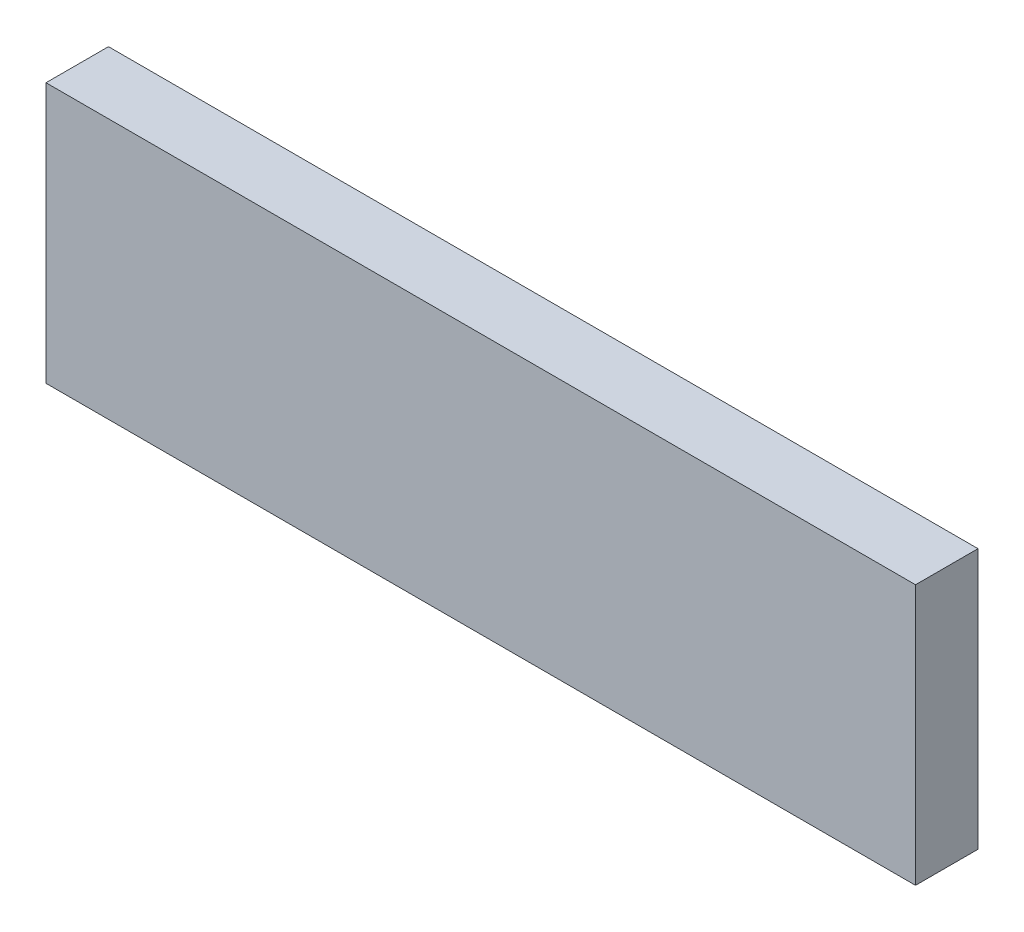
from build123d import *

# Parameters (mm, degrees)
ESBO_O1_W                = 167
ESBO_O1_H                = 50
RESSALTO_EXTRUS_O1_DEPTH = 6
ESBO_O3_R                = 1.5
CORTE_EXTRUS_O1_DEPTH    = 15


with BuildPart() as part:
    # Esboço1 → Ressalto-extrusão1 (new, symmetric)
    with BuildSketch(Plane.XY):
        Rectangle(ESBO_O1_W, ESBO_O1_H)
    extrude(amount=RESSALTO_EXTRUS_O1_DEPTH, both=True)

    # Esboço3 → Corte-extrusão1 (cut, symmetric)
    with BuildSketch(Plane(origin=(0, -25, 0), x_dir=(-1, 0, 0), z_dir=(0, -1, 0))):
        with Locations(Location((77.5, 0, 0), (0, 0, 90))):
            Circle(ESBO_O3_R)
        with Locations(Location((-77.5, 0, 0), (0, 0, 90))):
            Circle(ESBO_O3_R)
    extrude(amount=CORTE_EXTRUS_O1_DEPTH, both=True, mode=Mode.SUBTRACT)


solid = part.part
